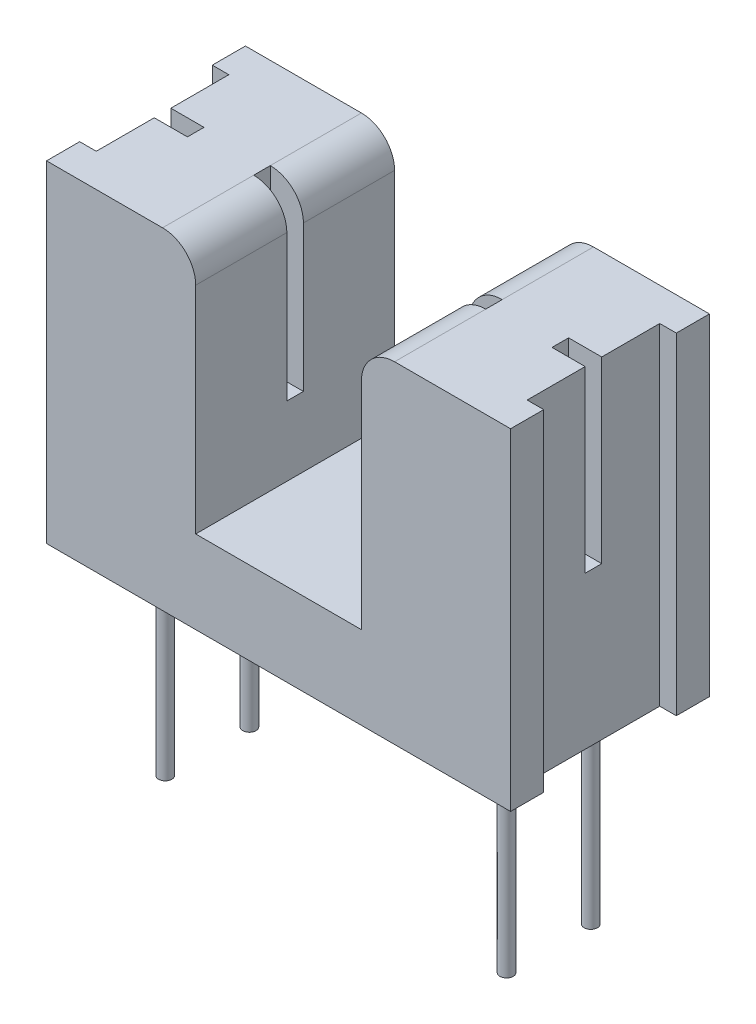
from build123d import *

# Parameters (mm, degrees)
BOSS_EXTRUDE1_DEPTH = 3
SKETCH4_W           = 0.5
SKETCH4_H           = 4
CUT_EXTRUDE2_DEPTH  = 13.56980509
SKETCH2_W           = 1
SKETCH2_H           = 0.5
CUT_EXTRUDE1_DEPTH  = 5.4
CUT_EXTRUDE3_DEPTH  = 1.5
SKETCH6_W           = 2.5
SKETCH6_H           = 5
CUT_EXTRUDE4_DEPTH  = 3
SKETCH7_R           = 0.2
BOSS_EXTRUDE2_DEPTH = 10.5


with BuildPart() as part:
    # Sketch1 → Boss-Extrude1 (new, symmetric)
    with BuildSketch(Plane.XY):
        with BuildLine():
            Line((-7, -5), (-7, 5))
            Line((-7, 5), (-3.5, 5))
            ThreePointArc((-3.5, 5), (-2.792893219, 4.707106781), (-2.5, 4))
            Line((-2.5, 4), (-2.5, -2.5))
            Line((-2.5, -2.5), (2.5, -2.5))
            Line((2.5, -2.5), (2.5, 4))
            ThreePointArc((2.5, 4), (2.792893219, 4.707106781), (3.5, 5))
            Line((3.5, 5), (7, 5))
            Line((7, 5), (7, -5))
            Line((7, -5), (-7, -5))
        make_face()
    extrude(amount=BOSS_EXTRUDE1_DEPTH, both=True)

    # Sketch4 → Cut-Extrude2 (cut, through all)
    with BuildSketch(Plane(origin=(0, 5, 0), x_dir=(1, 0, 0), z_dir=(0, 1, 0))):
        with Locations((-6.75, 0)):
            Rectangle(SKETCH4_W, SKETCH4_H)
        with Locations((6.75, 0)):
            Rectangle(SKETCH4_W, SKETCH4_H)
    extrude(amount=-CUT_EXTRUDE2_DEPTH, mode=Mode.SUBTRACT)

    # Sketch2 → Cut-Extrude1 (cut)
    with BuildSketch(Plane(origin=(0, 5, 0), x_dir=(1, 0, 0), z_dir=(0, 1, 0))):
        with Locations((-6, 0)):
            Rectangle(SKETCH2_W, SKETCH2_H)
        with Locations((-3, 0)):
            Rectangle(SKETCH2_W, SKETCH2_H)
        with Locations((3, 0)):
            Rectangle(SKETCH2_W, SKETCH2_H)
        with Locations((6, 0)):
            Rectangle(SKETCH2_W, SKETCH2_H)
    extrude(amount=-CUT_EXTRUDE1_DEPTH, mode=Mode.SUBTRACT)

    # Sketch5 → Cut-Extrude3 (cut)
    with BuildSketch(Plane.XZ.offset(5)):
        Polygon((-6, 2.5), (-3.5, 2.5), (-3.5, 1), (-2.5, 1), (-2.5, 2), (2.5, 2), (2.5, 1), (3.5, 1), (3.5, 2.5), (6, 2.5), (6, -2.5), (3.5, -2.5), (3.5, -1), (2.5, -1), (2.5, -2), (-2.5, -2), (-2.5, -1), (-3.5, -1), (-3.5, -2.5), (-6, -2.5), align=None)
    extrude(amount=-CUT_EXTRUDE3_DEPTH, mode=Mode.SUBTRACT)

    # Sketch6 → Cut-Extrude4 (cut)
    with BuildSketch(Plane.XZ.offset(3.5)):
        with Locations((-4.75, 0)):
            Rectangle(SKETCH6_W, SKETCH6_H)
        with Locations((4.75, 0)):
            Rectangle(SKETCH6_W, SKETCH6_H)
    extrude(amount=-CUT_EXTRUDE4_DEPTH, mode=Mode.SUBTRACT)

    # Sketch7 → Boss-Extrude2 (add)
    with BuildSketch(Plane.XZ.offset(0.5)):
        with Locations(Location((-5.15, -1.27, 0), (0, 0, 90))):
            Circle(SKETCH7_R)
        with Locations(Location((-5.15, 1.27, 0), (0, 0, 90))):
            Circle(SKETCH7_R)
        with Locations(Location((5.15, 1.27, 0), (0, 0, 90))):
            Circle(SKETCH7_R)
        with Locations(Location((5.15, -1.27, 0), (0, 0, 90))):
            Circle(SKETCH7_R)
    extrude(amount=BOSS_EXTRUDE2_DEPTH)


solid = part.part
